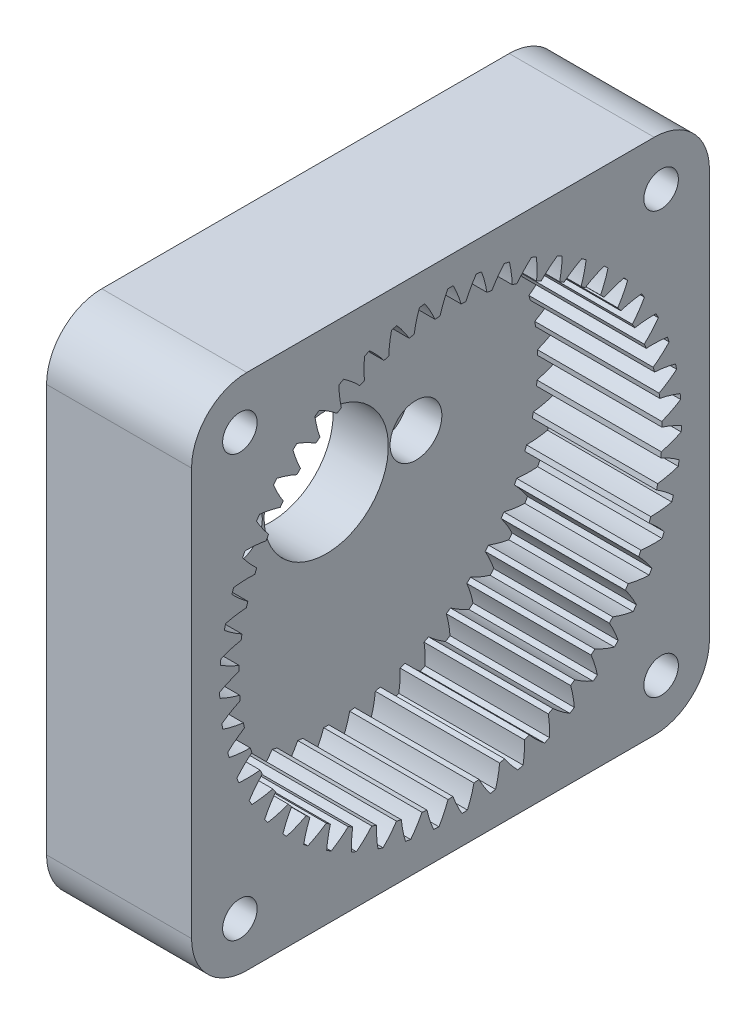
from build123d import *

# Parameters (mm, degrees)
BASPROSKE_W         = 12
BASPROSKE_H         = 6.875
TOOTHCUT_DEPTH      = 55.373706881
TEETHCUTS_COUNT     = 51
TEETHCUTS_ANGLE     = 352.941176471
BOSS_EXTRUDE1_DEPTH = 12
SKETCH2_W           = 75
SKETCH2_H           = 75
BOSS_EXTRUDE2_DEPTH = 3
CUT_EXTRUDE1_DEPTH  = 56.113519213
SKETCH4_W           = 75
SKETCH4_H           = 75
BOSS_EXTRUDE3_DEPTH = 6
BOSS_EXTRUDE4_START = 5
SKETCH6_R           = 20
SKETCH6_R_2         = 9
SKETCH6_R_3         = 2
BOSS_EXTRUDE4_DEPTH = 5
SKETCH7_R           = 2
CUT_EXTRUDE2_DEPTH  = 58.039460025
SKETCH8_R           = 3.75
CUT_EXTRUDE4_DEPTH  = 5
SKETCH9_R           = 2.5
CUT_EXTRUDE5_DEPTH  = 60.063525123
FILLET1_R           = 8


with BuildPart() as part:
    # BasProSke → Base-Revolve (revolve)
    with BuildSketch(Plane(origin=(0, 0, 0), x_dir=(1, 0, 0), z_dir=(0, 1, 0)), mode=Mode.PRIVATE) as base_revolve_sk:
        with Locations((6, 34.0625)):
            Rectangle(BASPROSKE_W, BASPROSKE_H)
    revolve(base_revolve_sk.sketch.rotate(Axis((-10, 0, 0), (1, 0, 0)), 180), axis=Axis((-10, 0, 0), (1, 0, 0)))

    # TooCutSke → ToothCut (cut, through all)
    with BuildSketch(Plane(origin=(0, 0, 0), x_dir=(0, 0, -1), z_dir=(1, 0, 0))):
        with BuildLine():
            ThreePointArc((1.527149247, 30.561468148), (1.027769016, 32.026530559), (0.388626398, 33.436241592))
            ThreePointArc((0.388626398, 33.436241592), (0, 33.4385), (-0.388626398, 33.436241592))
            ThreePointArc((-0.388626398, 33.436241592), (-1.027769016, 32.026530559), (-1.527149247, 30.561468148))
            ThreePointArc((-1.527149247, 30.561468148), (0, 30.5996), (1.527149247, 30.561468148))
        make_face()
    toothcut = extrude(amount=TOOTHCUT_DEPTH, mode=Mode.SUBTRACT)

    # TeethCuts: ToothCut ×51 about axis
    teethcuts_axis = Axis((-10, 0, 0), (1, 0, 0))
    for i in range(1, TEETHCUTS_COUNT):
        add(toothcut.rotate(teethcuts_axis, i * TEETHCUTS_ANGLE / (TEETHCUTS_COUNT - 1)), mode=Mode.SUBTRACT)

    # Sketch1 → Boss-Extrude1 (add)
    with BuildSketch(Plane(origin=(12, 0, 0), x_dir=(0, 0, -1), z_dir=(1, 0, 0))):
        with BuildLine():
            Line((-8.4e-08, 37.5), (-37.5, 37.5))
            Line((-37.5, 37.5), (-37.5, 0))
            ThreePointArc((-37.5, 0), (-26.516504324, 26.516504265), (-8.4e-08, 37.5))
        make_face()
        with BuildLine():
            Line((37.5, 37.5), (-8.4e-08, 37.5))
            ThreePointArc((-8.4e-08, 37.5), (26.516504265, 26.516504324), (37.5, 0))
            Line((37.5, 0), (37.5, 37.5))
        make_face()
        with BuildLine():
            Line((37.5, -37.5), (37.5, 0))
            ThreePointArc((37.5, 0), (26.516504279, -26.51650431), (-4.4e-08, -37.5))
            Line((-4.4e-08, -37.5), (37.5, -37.5))
        make_face()
        with BuildLine():
            ThreePointArc((-4.4e-08, -37.5), (-26.51650431, -26.516504279), (-37.5, 0))
            Line((-37.5, 0), (-37.5, -37.5))
            Line((-37.5, -37.5), (-4.4e-08, -37.5))
        make_face()
    extrude(amount=-BOSS_EXTRUDE1_DEPTH)

    # Sketch2 → Boss-Extrude2 (add)
    with BuildSketch(Plane.ZY):
        Rectangle(SKETCH2_W, SKETCH2_H)
    extrude(amount=BOSS_EXTRUDE2_DEPTH)

    # Sketch3 → Cut-Extrude1 (cut, through all)
    with BuildSketch(Plane.ZY.offset(3)):
        with BuildLine():
            ThreePointArc((9, 0), (6.363961031, 6.363961031), (0, 9))
            Line((0, 9), (0, -9))
            ThreePointArc((0, -9), (6.363961031, -6.363961031), (9, 0))
        make_face()
        with BuildLine():
            Line((0, -9), (0, 9))
            ThreePointArc((0, 9), (-9, 0), (0, -9))
        make_face()
    extrude(amount=-CUT_EXTRUDE1_DEPTH, mode=Mode.SUBTRACT)

    # Sketch4 → Boss-Extrude3 (add)
    with BuildSketch(Plane(origin=(12, 0, 0), x_dir=(0, 0, -1), z_dir=(1, 0, 0))):
        Rectangle(SKETCH4_W, SKETCH4_H)
        with BuildLine():
            ThreePointArc((3.723241767, 33.230569556), (2.922152095, 31.921865225), (2.250627887, 30.54218884))
            ThreePointArc((2.250627887, 30.54218884), (1.88530275, 30.566914443), (1.519708105, 30.587270429))
            ThreePointArc((1.519708105, 30.587270429), (1.022819781, 32.039012032), (0.388626398, 33.436241592))
            ThreePointArc((0.388626398, 33.436241592), (0, 33.4385), (-0.388626398, 33.436241592))
            ThreePointArc((-0.388626398, 33.436241592), (-1.022819781, 32.039012032), (-1.519708105, 30.587270429))
            ThreePointArc((-1.519708105, 30.587270429), (-1.88530275, 30.566914443), (-2.250627887, 30.54218884))
            ThreePointArc((-2.250627887, 30.54218884), (-2.922152095, 31.921865225), (-3.723241767, 33.230569556))
            ThreePointArc((-3.723241767, 33.230569556), (-4.109200107, 33.185053213), (-4.494603383, 33.135054288))
            ThreePointArc((-4.494603383, 33.135054288), (-4.952286751, 31.670480076), (-5.267006871, 30.168680177))
            ThreePointArc((-5.267006871, 30.168680177), (-5.627328983, 30.103551178), (-5.986846655, 30.034118801))
            ThreePointArc((-5.986846655, 30.034118801), (-6.822827124, 31.32081548), (-7.778669383, 32.521155959))
            ThreePointArc((-7.778669383, 32.521155959), (-8.15610893, 32.428554846), (-8.532446763, 32.331573338))
            ThreePointArc((-8.532446763, 32.331573338), (-8.806682103, 30.821855924), (-8.934463182, 29.292763486))
            ThreePointArc((-8.934463182, 29.292763486), (-9.284050645, 29.183848763), (-9.632310929, 29.070762136))
            ThreePointArc((-9.632310929, 29.070762136), (-10.620075048, 30.244974099), (-11.7161803, 31.318754787))
            ThreePointArc((-11.7161803, 31.318754787), (-12.079379455, 31.180472643), (-12.440946947, 31.037978692))
            ThreePointArc((-12.440946947, 31.037978692), (-12.527577131, 29.506003856), (-12.466482138, 27.97279836))
            ThreePointArc((-12.466482138, 27.97279836), (-12.800035562, 27.821748949), (-13.131759189, 27.66672235))
            ThreePointArc((-13.131759189, 27.66672235), (-14.25633346, 28.710649741), (-15.476085866, 29.641593218))
            ThreePointArc((-15.476085866, 29.641593218), (-15.8195389, 29.459726259), (-16.160855057, 29.273879928))
            ThreePointArc((-16.160855057, 29.273879928), (-16.058566859, 27.742870845), (-15.809521933, 26.228794125))
            ThreePointArc((-15.809521933, 26.228794125), (-16.121984988, 26.037899782), (-16.432143365, 25.843283256))
            ThreePointArc((-16.432143365, 25.843283256), (-17.676480389, 26.741101199), (-19.001389746, 27.515095311))
            ThreePointArc((-19.001389746, 27.515095311), (-19.319890262, 27.292400454), (-19.635781078, 27.066018985))
            ThreePointArc((-19.635781078, 27.066018985), (-19.346125083, 25.559184192), (-18.912905491, 24.087188107))
            ThreePointArc((-18.912905491, 24.087188107), (-19.199541556, 23.859342595), (-19.483432998, 23.62808633))
            ThreePointArc((-19.483432998, 23.62808633), (-20.828669894, 24.366184821), (-22.238651927, 24.971496606))
            ThreePointArc((-22.238651927, 24.971496606), (-22.52737178, 24.711349678), (-22.813048674, 24.447864783))
            ThreePointArc((-22.813048674, 24.447864783), (-22.340415771, 22.98804636), (-21.72958868, 21.58044487))
            ThreePointArc((-21.72958868, 21.58044487), (-21.986052644, 21.319102095), (-22.239373647, 21.054711701))
            ThreePointArc((-22.239373647, 21.054711701), (-23.665117995, 21.621901919), (-25.138798813, 22.049355467))
            ThreePointArc((-25.138798813, 22.049355467), (-25.393361306, 21.755700031), (-25.644493706, 21.459105872))
            ThreePointArc((-25.644493706, 21.459105872), (-24.996048529, 20.068433178), (-24.216873454, 18.746564088))
            ThreePointArc((-24.216873454, 18.746564088), (-24.439277585, 18.455685739), (-24.658188061, 18.162169104))
            ThreePointArc((-24.658188061, 18.162169104), (-26.142827029, 18.549853024), (-27.657867134, 18.792968575))
            ThreePointArc((-27.657867134, 18.792968575), (-27.874413358, 18.470256148), (-28.087194353, 18.14504879))
            ThreePointArc((-28.087194353, 18.14504879), (-27.272766671, 16.844603006), (-26.337055113, 15.628504502))
            ThreePointArc((-26.337055113, 15.628504502), (-26.522027991, 15.3125), (-26.703209479, 14.994306537))
            ThreePointArc((-26.703209479, 14.994306537), (-28.224237455, 15.196607265), (-29.757670382, 15.251699436))
            ThreePointArc((-29.757670382, 15.251699436), (-29.932917718, 14.90482201), (-30.104121765, 14.555931265))
            ThreePointArc((-30.104121765, 14.555931265), (-29.13605747, 13.365425822), (-28.057993862, 12.27353272))
            ThreePointArc((-28.057993862, 12.27353272), (-28.202731487, 11.93719237), (-28.343437461, 11.599145568))
            ThreePointArc((-28.343437461, 11.599145568), (-29.877797211, 11.612996431), (-31.406377681, 11.47923008))
            ThreePointArc((-31.406377681, 11.47923008), (-31.537669557, 11.113445962), (-31.664701378, 10.746160659))
            ThreePointArc((-31.664701378, 10.746160659), (-30.557675337, 9.683642407), (-29.353602026, 8.732506692))
            ThreePointArc((-29.353602026, 8.732506692), (-29.455910322, 8.380929071), (-29.554007823, 8.028153375))
            ThreePointArc((-29.554007823, 8.028153375), (-31.078440017, 7.853344409), (-32.578996307, 7.532747298))
            ThreePointArc((-32.578996307, 7.532747298), (-32.664342473, 7.153601403), (-32.745276395, 6.773489211))
            ThreePointArc((-32.745276395, 6.773489211), (-31.516069995, 5.855064845), (-30.204239504, 5.059104764))
            ThreePointArc((-30.204239504, 5.059104764), (-30.262567582, 4.697619431), (-30.316569552, 4.335462561))
            ThreePointArc((-30.316569552, 4.335462561), (-31.807965352, 3.974643691), (-33.257750559, 3.472075745))
            ThreePointArc((-33.257750559, 3.472075745), (-33.295857254, 3.085315538), (-33.3294664, 2.698138572))
            ThreePointArc((-33.3294664, 2.698138572), (-31.996713158, 1.937730467), (-30.597011499, 1.309011965))
            ThreePointArc((-30.597011499, 1.309011965), (-30.610475166, 0.943098668), (-30.619562989, 0.577050553))
            ThreePointArc((-30.619562989, 0.577050553), (-32.055314355, 0.035691426), (-33.432351214, -0.641228938))
            ThreePointArc((-33.432351214, -0.641228938), (-33.422640779, -1.029740566), (-33.408415669, -1.418113098))
            ThreePointArc((-33.408415669, -1.418113098), (-31.992318765, -2.008977929), (-30.525963989, -2.460924121))
            ThreePointArc((-30.525963989, -2.460924121), (-30.494359149, -2.825718509), (-30.458395064, -3.190108953))
            ThreePointArc((-30.458395064, -3.190108953), (-31.816737468, -3.903801885), (-33.100151503, -4.744813243))
            ThreePointArc((-33.100151503, -4.744813243), (-33.042771138, -5.129186852), (-32.980927411, -5.512867619))
            ThreePointArc((-32.980927411, -5.512867619), (-31.502953431, -5.925232268), (-29.992173982, -6.193555106))
            ThreePointArc((-29.992173982, -6.193555106), (-29.915979731, -6.551700673), (-29.835508917, -6.908909658))
            ThreePointArc((-29.835508917, -6.908909658), (-31.095851274, -7.784117538), (-32.266187236, -8.776471016))
            ThreePointArc((-32.266187236, -8.776471016), (-32.162006769, -9.150879894), (-32.053481912, -9.524052686))
            ThreePointArc((-32.053481912, -9.524052686), (-30.536035435, -9.751666125), (-29.003733189, -9.832298109))
            ThreePointArc((-29.003733189, -9.832298109), (-28.884104556, -10.178365734), (-28.760346867, -10.522978336))
            ThreePointArc((-28.760346867, -10.522978336), (-29.903583671, -11.546433904), (-30.943100461, -12.675086434))
            ThreePointArc((-30.943100461, -12.675086434), (-30.793699162, -13.033854924), (-30.640138301, -13.390862823))
            ThreePointArc((-30.640138301, -13.390862823), (-29.106222268, -13.430274664), (-27.575625366, -13.321993495))
            ThreePointArc((-27.575625366, -13.321993495), (-27.414375798, -13.650737146), (-27.249207276, -13.977529389))
            ThreePointArc((-27.249207276, -13.977529389), (-28.258008222, -15.133718102), (-29.150947824, -16.381560463))
            ThreePointArc((-29.150947824, -16.381560463), (-28.958590464, -16.71925), (-28.762321426, -17.054681129))
            ThreePointArc((-28.762321426, -17.054681129), (-27.235188441, -16.90529393), (-25.729499171, -16.609741039))
            ThreePointArc((-25.729499171, -16.609741039), (-25.529073047, -16.916177297), (-25.324997479, -17.220195345))
            ThreePointArc((-25.324997479, -17.220195345), (-26.184070173, -18.49159056), (-26.916896534, -19.839706733))
            ThreePointArc((-26.916896534, -19.839706733), (-26.684499054, -20.151198289), (-26.448497078, -20.459967854))
            ThreePointArc((-26.448497078, -20.459967854), (-24.95129692, -20.124046171), (-23.493339996, -19.645701841))
            ThreePointArc((-23.493339996, -19.645701841), (-23.256775573, -19.925185444), (-23.016886534, -20.201820692))
            ThreePointArc((-23.016886534, -20.201820692), (-23.713208311, -21.569149355), (-24.274812529, -22.997103273))
            ThreePointArc((-24.274812529, -22.997103273), (-24.005897839, -23.277674952), (-23.733740473, -23.555102322))
            ThreePointArc((-23.733740473, -23.555102322), (-22.289169171, -23.037738386), (-20.901045735, -22.383853828))
            ThreePointArc((-20.901045735, -22.383853828), (-20.631929087, -22.63214809), (-20.359863052, -22.87720703))
            ThreePointArc((-20.359863052, -22.87720703), (-20.882878383, -24.319741831), (-21.264747111, -25.805887169))
            ThreePointArc((-21.264747111, -25.805887169), (-20.963391683, -26.051285791), (-20.659204556, -26.29316545))
            ThreePointArc((-20.659204556, -26.29316545), (-19.289160338, -25.602201971), (-17.991912926, -24.782689408))
            ThreePointArc((-17.991912926, -24.782689408), (-17.694323587, -24.996030441), (-17.3942048, -25.205798229))
            ThreePointArc((-17.3942048, -25.205798229), (-17.735985305, -26.701671812), (-17.932329803, -28.22348012))
            ThreePointArc((-17.932329803, -28.22348012), (-17.603101878, -28.429985693), (-17.271496157, -28.632650991))
            ThreePointArc((-17.271496157, -28.632650991), (-15.996747496, -27.778562271), (-14.810041056, -26.805844678))
            ThreePointArc((-14.810041056, -26.805844678), (-14.488490178, -26.98099845), (-14.164868134, -27.152295221))
            ThreePointArc((-14.164868134, -27.152295221), (-14.320232769, -28.678831666), (-14.328076654, -30.213233883))
            ThreePointArc((-14.328076654, -30.213233883), (-13.975966992, -30.377715992), (-13.621969481, -30.538094729))
            ThreePointArc((-13.621969481, -30.538094729), (-12.461840268, -29.533827883), (-11.403664061, -28.422650668))
            ThreePointArc((-11.403664061, -28.422650668), (-11.063026027, -28.556962026), (-10.720806506, -28.687191094))
            ThreePointArc((-10.720806506, -28.687191094), (-10.687400101, -30.221249666), (-10.506624468, -31.744985817))
            ThreePointArc((-10.506624468, -31.744985817), (-10.136970693, -31.864951081), (-9.765947634, -31.980612081))
            ThreePointArc((-9.765947634, -31.980612081), (-8.738024245, -30.841390769), (-7.824419143, -29.608598246))
            ThreePointArc((-7.824419143, -29.608598246), (-7.469857678, -29.700031166), (-7.114228379, -29.787218393))
            ThreePointArc((-7.114228379, -29.787218393), (-6.892557343, -31.305544326), (-6.525902565, -32.795516126))
            ThreePointArc((-6.525902565, -32.795516126), (-6.144308252, -32.869145994), (-5.761883975, -32.938335952))
            ThreePointArc((-5.761883975, -32.938335952), (-4.881748682, -31.681429609), (-4.126564006, -30.345709656))
            ThreePointArc((-4.126564006, -30.345709656), (-3.763453902, -30.392878109), (-3.399805802, -30.435701824))
            ThreePointArc((-3.399805802, -30.435701824), (-2.99323044, -31.915278846), (-2.446254632, -33.34889984))
            ThreePointArc((-2.446254632, -33.34889984), (-2.05850436, -33.375078158), (-1.670476029, -33.396748226))
            ThreePointArc((-1.670476029, -33.396748226), (-0.951470784, -32.041210271), (-0.366154366, -30.62281104))
            ThreePointArc((-0.366154366, -30.62281104), (0, -30.625), (0.366154366, -30.62281104))
            ThreePointArc((0.366154366, -30.62281104), (0.951470784, -32.041210271), (1.670476029, -33.396748226))
            ThreePointArc((1.670476029, -33.396748226), (2.05850436, -33.375078158), (2.446254632, -33.34889984))
            ThreePointArc((2.446254632, -33.34889984), (2.99323044, -31.915278846), (3.399805802, -30.435701824))
            ThreePointArc((3.399805802, -30.435701824), (3.763453902, -30.392878109), (4.126564006, -30.345709656))
            ThreePointArc((4.126564006, -30.345709656), (4.881748682, -31.681429609), (5.761883975, -32.938335952))
            ThreePointArc((5.761883975, -32.938335952), (6.144308252, -32.869145994), (6.525902565, -32.795516126))
            ThreePointArc((6.525902565, -32.795516126), (6.892557343, -31.305544326), (7.114228379, -29.787218393))
            ThreePointArc((7.114228379, -29.787218393), (7.469857678, -29.700031166), (7.824419143, -29.608598246))
            ThreePointArc((7.824419143, -29.608598246), (8.738024245, -30.841390769), (9.765947634, -31.980612081))
            ThreePointArc((9.765947634, -31.980612081), (10.136970693, -31.864951081), (10.506624468, -31.744985817))
            ThreePointArc((10.506624468, -31.744985817), (10.687400101, -30.221249666), (10.720806506, -28.687191094))
            ThreePointArc((10.720806506, -28.687191094), (11.063026027, -28.556962026), (11.403664061, -28.422650668))
            ThreePointArc((11.403664061, -28.422650668), (12.461840268, -29.533827883), (13.621969481, -30.538094729))
            ThreePointArc((13.621969481, -30.538094729), (13.975966992, -30.377715992), (14.328076654, -30.213233883))
            ThreePointArc((14.328076654, -30.213233883), (14.320232769, -28.678831666), (14.164868134, -27.152295221))
            ThreePointArc((14.164868134, -27.152295221), (14.488490178, -26.98099845), (14.810041056, -26.805844678))
            ThreePointArc((14.810041056, -26.805844678), (15.996747496, -27.778562271), (17.271496157, -28.632650991))
            ThreePointArc((17.271496157, -28.632650991), (17.603101878, -28.429985693), (17.932329803, -28.22348012))
            ThreePointArc((17.932329803, -28.22348012), (17.735985305, -26.701671812), (17.3942048, -25.205798229))
            ThreePointArc((17.3942048, -25.205798229), (17.694323587, -24.996030441), (17.991912926, -24.782689408))
            ThreePointArc((17.991912926, -24.782689408), (19.289160338, -25.602201971), (20.659204556, -26.29316545))
            ThreePointArc((20.659204556, -26.29316545), (20.963391683, -26.051285791), (21.264747111, -25.805887169))
            ThreePointArc((21.264747111, -25.805887169), (20.882878383, -24.319741831), (20.359863052, -22.87720703))
            ThreePointArc((20.359863052, -22.87720703), (20.631929087, -22.63214809), (20.901045735, -22.383853828))
            ThreePointArc((20.901045735, -22.383853828), (22.289169171, -23.037738386), (23.733740473, -23.555102322))
            ThreePointArc((23.733740473, -23.555102322), (24.005897839, -23.277674952), (24.274812529, -22.997103273))
            ThreePointArc((24.274812529, -22.997103273), (23.713208311, -21.569149355), (23.016886534, -20.201820692))
            ThreePointArc((23.016886534, -20.201820692), (23.256775573, -19.925185444), (23.493339996, -19.645701841))
            ThreePointArc((23.493339996, -19.645701841), (24.95129692, -20.124046171), (26.448497078, -20.459967854))
            ThreePointArc((26.448497078, -20.459967854), (26.684499054, -20.151198289), (26.916896534, -19.839706733))
            ThreePointArc((26.916896534, -19.839706733), (26.184070173, -18.49159056), (25.324997479, -17.220195345))
            ThreePointArc((25.324997479, -17.220195345), (25.529073047, -16.916177297), (25.729499171, -16.609741039))
            ThreePointArc((25.729499171, -16.609741039), (27.235188441, -16.90529393), (28.762321426, -17.054681129))
            ThreePointArc((28.762321426, -17.054681129), (28.958590464, -16.71925), (29.150947824, -16.381560463))
            ThreePointArc((29.150947824, -16.381560463), (28.258008222, -15.133718102), (27.249207276, -13.977529389))
            ThreePointArc((27.249207276, -13.977529389), (27.414375798, -13.650737146), (27.575625366, -13.321993495))
            ThreePointArc((27.575625366, -13.321993495), (29.106222268, -13.430274664), (30.640138301, -13.390862823))
            ThreePointArc((30.640138301, -13.390862823), (30.793699162, -13.033854924), (30.943100461, -12.675086434))
            ThreePointArc((30.943100461, -12.675086434), (29.903583671, -11.546433904), (28.760346867, -10.522978336))
            ThreePointArc((28.760346867, -10.522978336), (28.884104556, -10.178365734), (29.003733189, -9.832298109))
            ThreePointArc((29.003733189, -9.832298109), (30.536035435, -9.751666125), (32.053481912, -9.524052686))
            ThreePointArc((32.053481912, -9.524052686), (32.162006769, -9.150879894), (32.266187236, -8.776471016))
            ThreePointArc((32.266187236, -8.776471016), (31.095851274, -7.784117538), (29.835508917, -6.908909658))
            ThreePointArc((29.835508917, -6.908909658), (29.915979731, -6.551700673), (29.992173982, -6.193555106))
            ThreePointArc((29.992173982, -6.193555106), (31.502953431, -5.925232268), (32.980927411, -5.512867619))
            ThreePointArc((32.980927411, -5.512867619), (33.042771138, -5.129186852), (33.100151503, -4.744813243))
            ThreePointArc((33.100151503, -4.744813243), (31.816737468, -3.903801885), (30.458395064, -3.190108953))
            ThreePointArc((30.458395064, -3.190108953), (30.494359149, -2.825718509), (30.525963989, -2.460924121))
            ThreePointArc((30.525963989, -2.460924121), (31.992318765, -2.008977929), (33.408415669, -1.418113098))
            ThreePointArc((33.408415669, -1.418113098), (33.422640779, -1.029740566), (33.432351214, -0.641228938))
            ThreePointArc((33.432351214, -0.641228938), (32.055314355, 0.035691426), (30.619562989, 0.577050553))
            ThreePointArc((30.619562989, 0.577050553), (30.610475166, 0.943098668), (30.597011499, 1.309011965))
            ThreePointArc((30.597011499, 1.309011965), (31.996713158, 1.937730467), (33.3294664, 2.698138572))
            ThreePointArc((33.3294664, 2.698138572), (33.295857254, 3.085315538), (33.257750559, 3.472075745))
            ThreePointArc((33.257750559, 3.472075745), (31.807965352, 3.974643691), (30.316569552, 4.335462561))
            ThreePointArc((30.316569552, 4.335462561), (30.262567582, 4.697619431), (30.204239504, 5.059104764))
            ThreePointArc((30.204239504, 5.059104764), (31.516069995, 5.855064845), (32.745276395, 6.773489211))
            ThreePointArc((32.745276395, 6.773489211), (32.664342473, 7.153601403), (32.578996307, 7.532747298))
            ThreePointArc((32.578996307, 7.532747298), (31.078440017, 7.853344409), (29.554007823, 8.028153375))
            ThreePointArc((29.554007823, 8.028153375), (29.455910322, 8.380929071), (29.353602026, 8.732506692))
            ThreePointArc((29.353602026, 8.732506692), (30.557675337, 9.683642407), (31.664701378, 10.746160659))
            ThreePointArc((31.664701378, 10.746160659), (31.537669557, 11.113445962), (31.406377681, 11.47923008))
            ThreePointArc((31.406377681, 11.47923008), (29.877797211, 11.612996431), (28.343437461, 11.599145568))
            ThreePointArc((28.343437461, 11.599145568), (28.202731487, 11.93719237), (28.057993862, 12.27353272))
            ThreePointArc((28.057993862, 12.27353272), (29.13605747, 13.365425822), (30.104121765, 14.555931265))
            ThreePointArc((30.104121765, 14.555931265), (29.932917718, 14.90482201), (29.757670382, 15.251699436))
            ThreePointArc((29.757670382, 15.251699436), (28.224237455, 15.196607265), (26.703209479, 14.994306537))
            ThreePointArc((26.703209479, 14.994306537), (26.522027991, 15.3125), (26.337055113, 15.628504502))
            ThreePointArc((26.337055113, 15.628504502), (27.272766671, 16.844603006), (28.087194353, 18.14504879))
            ThreePointArc((28.087194353, 18.14504879), (27.874413358, 18.470256148), (27.657867134, 18.792968575))
            ThreePointArc((27.657867134, 18.792968575), (26.142827029, 18.549853024), (24.658188061, 18.162169104))
            ThreePointArc((24.658188061, 18.162169104), (24.439277585, 18.455685739), (24.216873454, 18.746564088))
            ThreePointArc((24.216873454, 18.746564088), (24.996048529, 20.068433178), (25.644493706, 21.459105872))
            ThreePointArc((25.644493706, 21.459105872), (25.393361306, 21.755700031), (25.138798813, 22.049355467))
            ThreePointArc((25.138798813, 22.049355467), (23.665117995, 21.621901919), (22.239373647, 21.054711701))
            ThreePointArc((22.239373647, 21.054711701), (21.986052644, 21.319102095), (21.72958868, 21.58044487))
            ThreePointArc((21.72958868, 21.58044487), (22.340415771, 22.98804636), (22.813048674, 24.447864783))
            ThreePointArc((22.813048674, 24.447864783), (22.52737178, 24.711349678), (22.238651927, 24.971496606))
            ThreePointArc((22.238651927, 24.971496606), (20.828669894, 24.366184821), (19.483432998, 23.62808633))
            ThreePointArc((19.483432998, 23.62808633), (19.199541556, 23.859342595), (18.912905491, 24.087188107))
            ThreePointArc((18.912905491, 24.087188107), (19.346125083, 25.559184192), (19.635781078, 27.066018985))
            ThreePointArc((19.635781078, 27.066018985), (19.319890262, 27.292400454), (19.001389746, 27.515095311))
            ThreePointArc((19.001389746, 27.515095311), (17.676480389, 26.741101199), (16.432143365, 25.843283256))
            ThreePointArc((16.432143365, 25.843283256), (16.121984988, 26.037899782), (15.809521933, 26.228794125))
            ThreePointArc((15.809521933, 26.228794125), (16.058566859, 27.742870845), (16.160855057, 29.273879928))
            ThreePointArc((16.160855057, 29.273879928), (15.8195389, 29.459726259), (15.476085866, 29.641593218))
            ThreePointArc((15.476085866, 29.641593218), (14.25633346, 28.710649741), (13.131759189, 27.66672235))
            ThreePointArc((13.131759189, 27.66672235), (12.800035562, 27.821748949), (12.466482138, 27.97279836))
            ThreePointArc((12.466482138, 27.97279836), (12.527577131, 29.506003856), (12.440946947, 31.037978692))
            ThreePointArc((12.440946947, 31.037978692), (12.079379455, 31.180472643), (11.7161803, 31.318754787))
            ThreePointArc((11.7161803, 31.318754787), (10.620075048, 30.244974099), (9.632310929, 29.070762136))
            ThreePointArc((9.632310929, 29.070762136), (9.284050645, 29.183848763), (8.934463182, 29.292763486))
            ThreePointArc((8.934463182, 29.292763486), (8.806682103, 30.821855924), (8.532446763, 32.331573338))
            ThreePointArc((8.532446763, 32.331573338), (8.15610893, 32.428554846), (7.778669383, 32.521155959))
            ThreePointArc((7.778669383, 32.521155959), (6.822827124, 31.32081548), (5.986846655, 30.034118801))
            ThreePointArc((5.986846655, 30.034118801), (5.627328983, 30.103551178), (5.267006871, 30.168680177))
            ThreePointArc((5.267006871, 30.168680177), (4.952286751, 31.670480076), (4.494603383, 33.135054288))
            ThreePointArc((4.494603383, 33.135054288), (4.109200107, 33.185053213), (3.723241767, 33.230569556))
        make_face(mode=Mode.SUBTRACT)
    extrude(amount=BOSS_EXTRUDE3_DEPTH)

    # Sketch6 → Boss-Extrude4 (add)
    with BuildSketch(Plane.ZY.offset(3).offset(BOSS_EXTRUDE4_START)):
        Circle(SKETCH6_R)
        Circle(SKETCH6_R_2, mode=Mode.SUBTRACT)
        with Locations((-13, 0)):
            Circle(SKETCH6_R_3, mode=Mode.SUBTRACT)
        with Locations((13, 0)):
            Circle(SKETCH6_R_3, mode=Mode.SUBTRACT)
    extrude(amount=-BOSS_EXTRUDE4_DEPTH)

    # Sketch7 → Cut-Extrude2 (cut, through all)
    with BuildSketch(Plane.ZY.offset(3)):
        with Locations((-13, 0)):
            Circle(SKETCH7_R)
        with Locations((13, 0)):
            Circle(SKETCH7_R)
    extrude(amount=-CUT_EXTRUDE2_DEPTH, mode=Mode.SUBTRACT)

    # Sketch8 → Cut-Extrude4 (cut)
    with BuildSketch(Plane(origin=(0, 0, 0), x_dir=(0, 0, -1), z_dir=(1, 0, 0))):
        with Locations((-13, 0)):
            Circle(SKETCH8_R)
        with Locations((13, 0)):
            Circle(SKETCH8_R)
    extrude(amount=-CUT_EXTRUDE4_DEPTH, mode=Mode.SUBTRACT)

    # Sketch9 → Cut-Extrude5 (cut, through all)
    with BuildSketch(Plane(origin=(18, 0, 0), x_dir=(0, 0, -1), z_dir=(1, 0, 0))):
        with Locations((-30.5, 30.5)):
            Circle(SKETCH9_R)
        with Locations(Location((30.5, 30.5, 0), (0, 0, 180))):
            Circle(SKETCH9_R)
        with Locations((30.5, -30.5)):
            Circle(SKETCH9_R)
        with Locations(Location((-30.5, -30.5, 0), (0, 0, 180))):
            Circle(SKETCH9_R)
    extrude(amount=-CUT_EXTRUDE5_DEPTH, mode=Mode.SUBTRACT)

    # Fillet1
    fillet1_edges = [part.edges().sort_by_distance(p)[0] for p in [
        (7.5, 37.5, 37.5),
        (7.5, 37.5, -37.5),
        (7.5, -37.5, -37.5),
        (7.5, -37.5, 37.5),
    ]]
    fillet(fillet1_edges, radius=FILLET1_R)


solid = part.part
